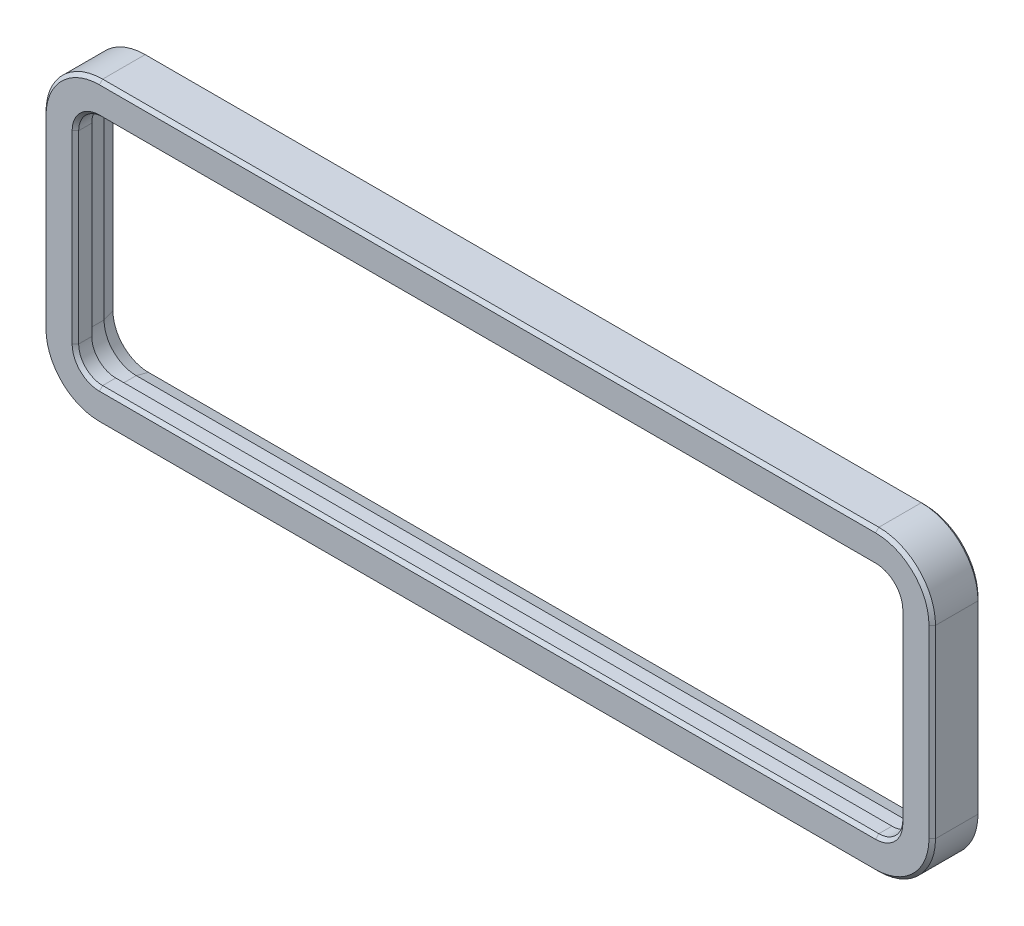
from build123d import *

# Parameters (mm, degrees)
SKETCH1_W           = 102.87
SKETCH1_H           = 30.48
BOSS_EXTRUDE1_DEPTH = 1.57
FILLET1_R           = 3.935
BOSS_EXTRUDE2_DEPTH = 2
BOSS_EXTRUDE4_DEPTH = 4
BOSS_EXTRUDE5_DEPTH = 2
CHAMFER1_SIZE       = 0.4
CHAMFER1_SIZE2      = 1.492820323
CHAMFER2_SIZE       = 0.4


with BuildPart() as part:
    # Sketch1 → Boss-Extrude1 (new body)
    with BuildSketch(Plane.XY):
        with Locations((51.435, 15.24)):
            Rectangle(SKETCH1_W, SKETCH1_H)
    extrude(amount=BOSS_EXTRUDE1_DEPTH)

    # Fillet1
    fillet1_edges = [part.edges().sort_by_distance(p)[0] for p in [
        (0, 30.48, 0.785),
        (102.87, 30.48, 0.785),
        (102.87, 0, 0.785),
        (0, 0, 0.785),
    ]]
    fillet(fillet1_edges, radius=FILLET1_R)


with BuildPart() as body_2:
    # Sketch7 → Boss-Extrude2 (new body)
    with BuildSketch(Plane.XY.offset(1.57)):
        with BuildLine():
            Line((-3, 26.545), (-3, 3.935))
            ThreePointArc((-3, 3.935), (-0.968785528, -0.968785528), (3.935, -3))
            Line((3.935, -3), (98.935, -3))
            ThreePointArc((98.935, -3), (103.838785528, -0.968785528), (105.87, 3.935))
            Line((105.87, 3.935), (105.87, 26.545))
            ThreePointArc((105.87, 26.545), (103.838785528, 31.448785528), (98.935, 33.48))
            Line((98.935, 33.48), (3.935, 33.48))
            ThreePointArc((3.935, 33.48), (-0.968785528, 31.448785528), (-3, 26.545))
        make_face()
        with BuildLine():
            Line((0, 26.545), (0, 3.935))
            ThreePointArc((0, 3.935), (1.152534816, 1.152534816), (3.935, 0))
            Line((3.935, 0), (98.935, 0))
            ThreePointArc((98.935, 0), (101.717465184, 1.152534816), (102.87, 3.935))
            Line((102.87, 3.935), (102.87, 26.545))
            ThreePointArc((102.87, 26.545), (101.717465184, 29.327465184), (98.935, 30.48))
            Line((98.935, 30.48), (3.935, 30.48))
            ThreePointArc((3.935, 30.48), (1.152534816, 29.327465184), (0, 26.545))
        make_face(mode=Mode.SUBTRACT)
    extrude(amount=BOSS_EXTRUDE2_DEPTH)

    # Sketch9 → Boss-Extrude4 (add)
    with BuildSketch(Plane(origin=(0, 0, 1.57), x_dir=(-1, 0, 0), z_dir=(0, 0, -1))):
        with BuildLine():
            Line((-3.935, 33.48), (-98.935, 33.48))
            ThreePointArc((-98.935, 33.48), (-103.838785528, 31.448785528), (-105.87, 26.545))
            Line((-105.87, 26.545), (-105.87, 3.935))
            ThreePointArc((-105.87, 3.935), (-103.838785528, -0.968785528), (-98.935, -3))
            Line((-98.935, -3), (-3.935, -3))
            ThreePointArc((-3.935, -3), (0.968785528, -0.968785528), (3, 3.935))
            Line((3, 3.935), (3, 26.545))
            ThreePointArc((3, 26.545), (0.968785528, 31.448785528), (-3.935, 33.48))
        make_face()
        with BuildLine():
            Line((-98.935, 0), (-3.935, 0))
            ThreePointArc((-3.935, 0), (-1.152534816, 1.152534816), (0, 3.935))
            Line((0, 3.935), (0, 26.545))
            ThreePointArc((0, 26.545), (-1.152534816, 29.327465184), (-3.935, 30.48))
            Line((-3.935, 30.48), (-98.935, 30.48))
            ThreePointArc((-98.935, 30.48), (-101.717465184, 29.327465184), (-102.87, 26.545))
            Line((-102.87, 26.545), (-102.87, 3.935))
            ThreePointArc((-102.87, 3.935), (-101.717465184, 1.152534816), (-98.935, 0))
        make_face(mode=Mode.SUBTRACT)
    extrude(amount=BOSS_EXTRUDE4_DEPTH)

    # Sketch11 → Boss-Extrude5 (add)
    with BuildSketch(Plane.XY.offset(3.57)):
        with BuildLine():
            Line((-3, 26.545), (-3, 3.935))
            ThreePointArc((-3, 3.935), (-0.968785528, -0.968785528), (3.935, -3))
            Line((3.935, -3), (98.935, -3))
            ThreePointArc((98.935, -3), (103.838785528, -0.968785528), (105.87, 3.935))
            Line((105.87, 3.935), (105.87, 26.545))
            ThreePointArc((105.87, 26.545), (103.838785528, 31.448785528), (98.935, 33.48))
            Line((98.935, 33.48), (3.935, 33.48))
            ThreePointArc((3.935, 33.48), (-0.968785528, 31.448785528), (-3, 26.545))
        make_face()
        with BuildLine():
            Line((101.87, 3.935), (101.87, 26.545))
            ThreePointArc((101.87, 26.545), (101.010358403, 28.620358403), (98.935, 29.48))
            Line((98.935, 29.48), (3.935, 29.48))
            ThreePointArc((3.935, 29.48), (1.859641597, 28.620358403), (1, 26.545))
            Line((1, 26.545), (1, 3.935))
            ThreePointArc((1, 3.935), (1.859641597, 1.859641597), (3.935, 1))
            Line((3.935, 1), (98.935, 1))
            ThreePointArc((98.935, 1), (101.010358403, 1.859641597), (101.87, 3.935))
        make_face(mode=Mode.SUBTRACT)
    extrude(amount=-BOSS_EXTRUDE5_DEPTH)

    # Chamfer1
    chamfer1_edges = [body_2.edges().sort_by_distance(p)[0] for p in [
        (101.717465184, 1.152534816, -2.43),
        (51.435, 0, -2.43),
        (1.152534816, 1.152534816, -2.43),
        (0, 15.24, -2.43),
        (1.152534816, 29.327465184, -2.43),
        (51.435, 30.48, -2.43),
        (101.717465184, 29.327465184, -2.43),
        (102.87, 15.24, -2.43),
    ]]
    chamfer1_side = [body_2.faces().sort_by_distance(p)[0] for p in [
        (-0.156890605, 30.636890605, -2.43),
    ]]
    chamfer(chamfer1_edges, length=CHAMFER1_SIZE, length2=CHAMFER1_SIZE2, reference=chamfer1_side[0])

    # Chamfer2
    chamfer2_edges = [body_2.edges().sort_by_distance(p)[0] for p in [
        (101.010358403, 1.859641597, 3.57),
        (51.435, 1, 3.57),
        (1.859641597, 1.859641597, 3.57),
        (1, 15.24, 3.57),
        (1.859641597, 28.620358403, 3.57),
        (51.435, 29.48, 3.57),
        (101.010358403, 28.620358403, 3.57),
        (101.87, 15.24, 3.57),
        (-0.968785528, -0.968785528, 3.57),
        (51.435, -3, 3.57),
        (103.838785528, -0.968785528, 3.57),
        (105.87, 15.24, 3.57),
        (103.838785528, 31.448785528, 3.57),
        (51.435, 33.48, 3.57),
        (-0.968785528, 31.448785528, 3.57),
        (-0.968785528, 31.448785528, -2.43),
        (51.435, 33.48, -2.43),
        (103.838785528, 31.448785528, -2.43),
        (105.87, 15.24, -2.43),
        (103.838785528, -0.968785528, -2.43),
        (51.435, -3, -2.43),
        (-0.968785528, -0.968785528, -2.43),
        (-3, 15.24, -2.43),
        (-3, 15.24, 3.57),
    ]]
    chamfer(chamfer2_edges, length=CHAMFER2_SIZE)


solid = body_2.part
